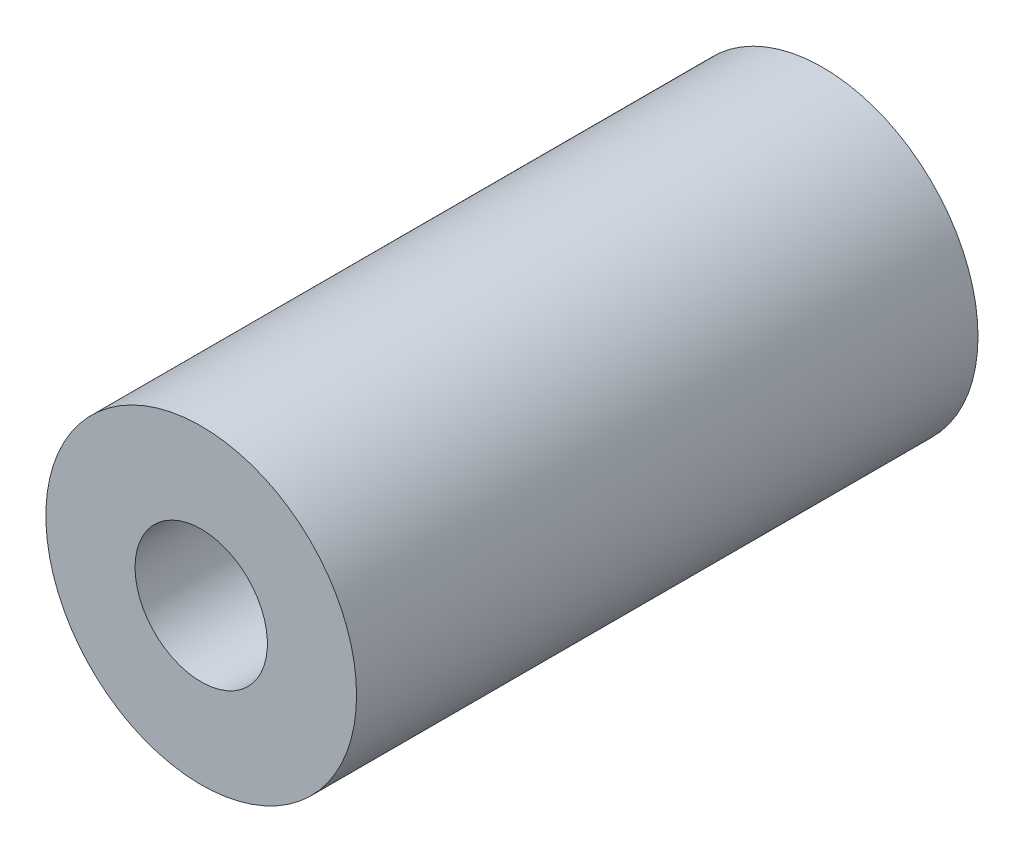
from build123d import *

# Parameters (mm, degrees)
SKETCH1_R             = 3.175
BOSS_EXTRUDE1_DEPTH   = 12.7
F_6_32_TAPPED_HOLE1_D = 2.7051


with BuildPart() as part:
    # Sketch1 → Boss-Extrude1 (new body)
    with BuildSketch(Plane.XY):
        Circle(SKETCH1_R)
    extrude(amount=BOSS_EXTRUDE1_DEPTH)

    # #6-32 Tapped Hole1 (through all)
    with Locations(Plane(origin=(0, 0, 0), x_dir=(-1, 0, 0), z_dir=(0, 0, -1))):
        with Locations((0, 0)):
            Hole(F_6_32_TAPPED_HOLE1_D / 2)


solid = part.part
